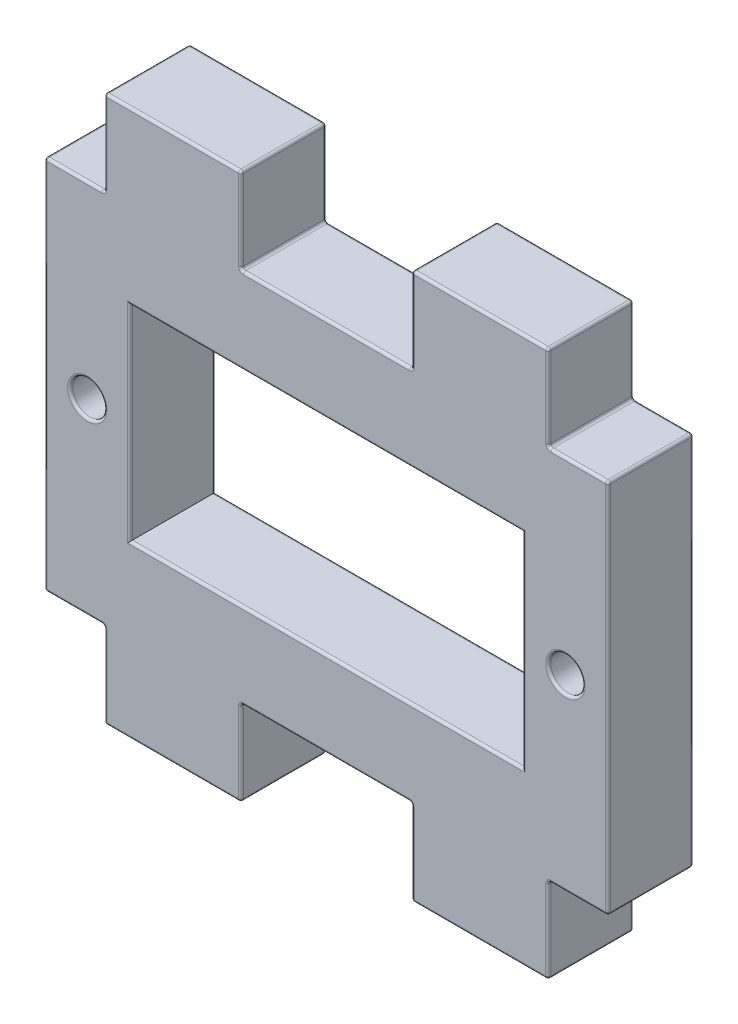
from build123d import *

# Parameters (mm, degrees)
SKETCH_1_W      = 33
SKETCH_1_H      = 22
SKETCH_1_R      = 1
SKETCH_1_W_2    = 23
SKETCH_1_H_2    = 12
SKETCH_1_W_3    = 8
SKETCH_1_H_3    = 5
EXTRUDE_1_DEPTH = 2.5
FILLET_3_R      = 0.15
FILLET_4_R      = 0.15


with BuildPart() as part:
    # 草图1 → 凸台-拉伸1 (new, symmetric)
    # profile 1 of 5: a face of its own
    with BuildSketch(Plane.XY):
        Rectangle(SKETCH_1_W, SKETCH_1_H)
        with Locations((-14, 0)):
            Circle(SKETCH_1_R, mode=Mode.SUBTRACT)
        with Locations((14, 0)):
            Circle(SKETCH_1_R, mode=Mode.SUBTRACT)
        Rectangle(SKETCH_1_W_2, SKETCH_1_H_2, mode=Mode.SUBTRACT)
    # profile 2 of 5: a face of its own
    with BuildSketch(Plane.XY):
        with Locations((-9, -13.5)):
            Rectangle(SKETCH_1_W_3, SKETCH_1_H_3)
    # profile 3 of 5: a face of its own
    with BuildSketch(Plane.XY):
        with Locations((9, -13.5)):
            Rectangle(SKETCH_1_W_3, SKETCH_1_H_3)
    # profile 4 of 5: a face of its own
    with BuildSketch(Plane.XY):
        with Locations((9, 13.5)):
            Rectangle(SKETCH_1_W_3, SKETCH_1_H_3)
    # profile 5 of 5: a face of its own
    with BuildSketch(Plane.XY):
        with Locations((-9, 13.5)):
            Rectangle(SKETCH_1_W_3, SKETCH_1_H_3)
    extrude(amount=EXTRUDE_1_DEPTH, both=True)

    # 圆角3
    fillet_3_edges = [part.edges().sort_by_distance(p)[0] for p in [
        (-16.5, 0, 2.5),
        (-14.75, -11, 2.5),
        (-13, -13.5, 2.5),
        (-9, -16, 2.5),
        (-13, 13.5, -2.5),
        (-9, 16, -2.5),
        (-5, 13.5, -2.5),
        (0, 11, -2.5),
        (5, 13.5, -2.5),
        (9, 16, -2.5),
        (-5, -13.5, 2.5),
        (13, 13.5, -2.5),
        (14.75, 11, -2.5),
        (16.5, 0, -2.5),
        (14.75, -11, -2.5),
        (13, -13.5, -2.5),
        (9, -16, -2.5),
        (5, -13.5, -2.5),
        (0, -11, -2.5),
        (-5, -13.5, -2.5),
        (-9, -16, -2.5),
        (0, -11, 2.5),
        (-13, -13.5, -2.5),
        (-14.75, -11, -2.5),
        (-16.5, 0, -2.5),
        (-14.75, 11, -2.5),
        (5, -13.5, 2.5),
        (9, -16, 2.5),
        (-13, 11, 0),
        (-13, 16, 0),
        (-5, 16, 0),
        (-5, 11, 0),
        (5, 11, 0),
        (5, 16, 0),
        (13, 16, 0),
        (13, 11, 0),
        (16.5, 11, 0),
        (16.5, -11, 0),
        (13, -11, 0),
        (13, -16, 0),
        (5, -16, 0),
        (5, -11, 0),
        (-5, -11, 0),
        (-5, -16, 0),
        (-13, -16, 0),
        (-13, -11, 0),
        (-16.5, -11, 0),
        (-16.5, 11, 0),
        (13, -13.5, 2.5),
        (14.75, -11, 2.5),
        (16.5, 0, 2.5),
        (14.75, 11, 2.5),
        (13, 13.5, 2.5),
        (9, 16, 2.5),
        (5, 13.5, 2.5),
        (-14.75, 11, 2.5),
        (0, 11, 2.5),
        (-5, 13.5, 2.5),
        (-9, 16, 2.5),
        (-13, 13.5, 2.5),
    ]]
    fillet(fillet_3_edges, radius=FILLET_3_R)

    # 圆角4
    fillet_4_edges = [part.edges().sort_by_distance(p)[0] for p in [
        (0, 6, 2.5),
        (11.5, 0, 2.5),
        (0, -6, 2.5),
        (-11.5, 0, 2.5),
        (-15, 0, 2.5),
        (13, 0, 2.5),
        (13, 0, -2.5),
        (-15, 0, -2.5),
        (-11.5, 0, -2.5),
        (0, -6, -2.5),
        (11.5, 0, -2.5),
        (0, 6, -2.5),
    ]]
    fillet(fillet_4_edges, radius=FILLET_4_R)


solid = part.part
